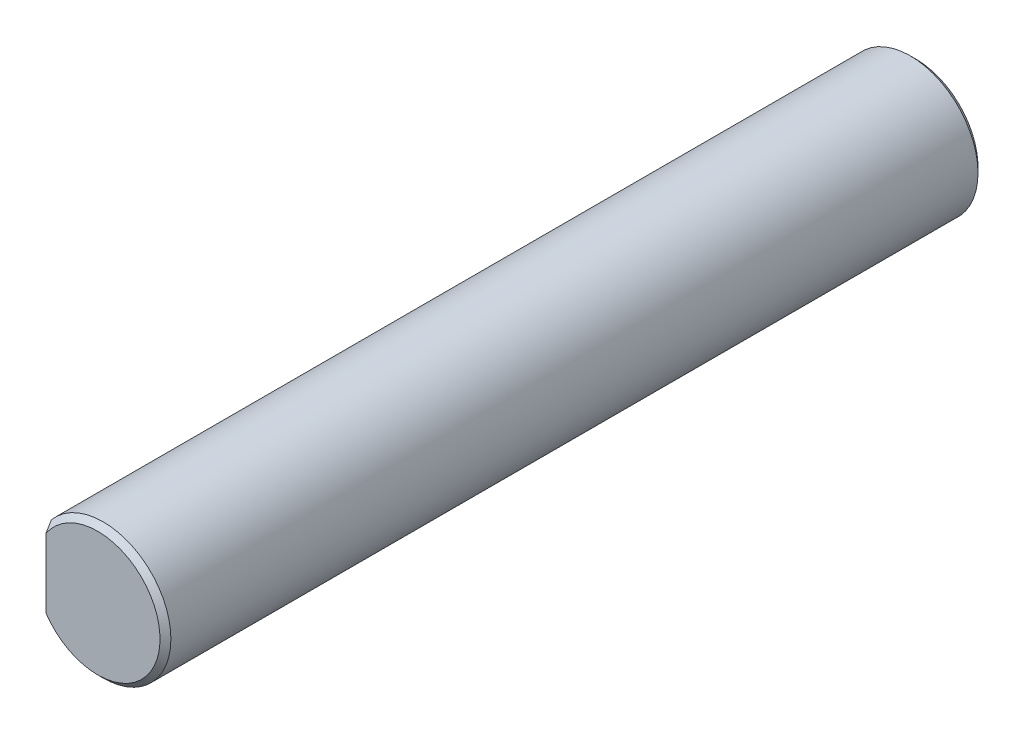
from build123d import *

# Parameters (mm, degrees)
BOSS_EXTRUDE1_DEPTH = 38.1
CHAMFER2_SIZE       = 0.254


with BuildPart() as part:
    # Sketch1 → Boss-Extrude1 (new body)
    with BuildSketch(Plane.XY):
        with BuildLine():
            ThreePointArc((3.1526721065787995, 0), (1.0816541511906828, 2.961311484597993), (-2.4104599999999996, 2.032000000000002))
            Line((-2.41046, 2.032), (-2.41046, -2.032))
            ThreePointArc((-2.4104600000000005, -2.032000000000001), (1.0816541511906834, -2.9613114845979926), (3.1526721065787995, -7.7e-16))
        make_face()
    extrude(amount=-BOSS_EXTRUDE1_DEPTH)

    # Chamfer2
    chamfer2_edges = [part.edges().sort_by_distance(p)[0] for p in [
        (3.152672106578799, -1.78e-15, -38.1),
        (3.1526721065788, 1.22e-15, 0),
    ]]
    chamfer(chamfer2_edges, length=CHAMFER2_SIZE)


solid = part.part
